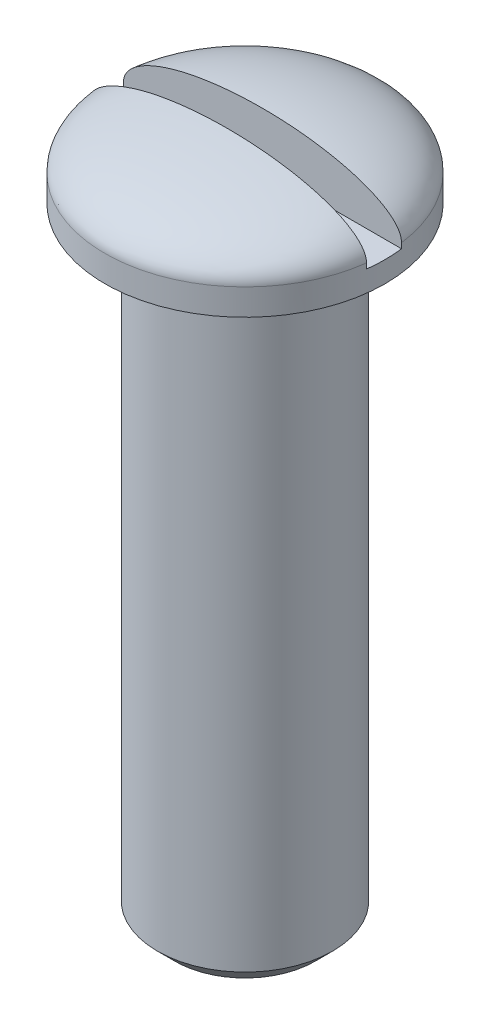
from build123d import *

# Parameters (mm, degrees)
SFAZOWANIE1_SIZE           = 1
SZKIC14_W                  = 16
SZKIC14_H                  = 2
WYTNIJ_WYCI_GNI_CIE1_DEPTH = 3


with BuildPart() as part:
    # Szkic1 → Obrót1 (revolve)
    with BuildSketch(Plane.XY):
        with BuildLine():
            Line((0, 0), (5, 0))
            Line((5, 0), (5, 35.5))
            Line((5, 35.5), (8, 35.5))
            Line((8, 35.5), (8, 37))
            add(Edge.make_bspline(
                [(8, 37), (8, 39.7), (0, 39.7)],
                knots=[0, 0, 0, 1.570796327, 1.570796327, 1.570796327], degree=2, weights=[1, 0.707106781, 1]))
            Line((0, 39.7), (0, 0))
        make_face()
    revolve(axis=Axis((0, 0, 0), (0, 1, 0)))

    # Sfazowanie1
    sfazowanie1_edges = [part.edges().sort_by_distance(p)[0] for p in [
        (-5, 0, 0),
    ]]
    chamfer(sfazowanie1_edges, length=SFAZOWANIE1_SIZE)

    # Szkic14 → Wytnij-wyciągnięcie1 (cut)
    with BuildSketch(Plane(origin=(0, 39.7, 0), x_dir=(1, 0, 0), z_dir=(0, 1, 0))):
        Rectangle(SZKIC14_W, SZKIC14_H)
    extrude(amount=-WYTNIJ_WYCI_GNI_CIE1_DEPTH, mode=Mode.SUBTRACT)


solid = part.part
